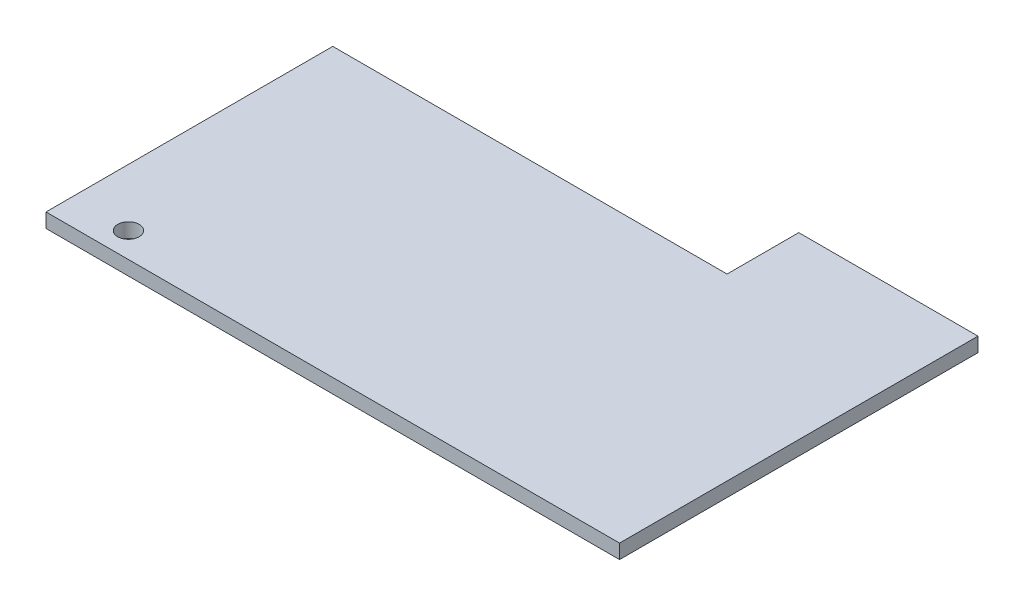
from build123d import *

# Parameters (mm, degrees)
SKETCH1_W           = 80
SKETCH1_H           = 50
BOSS_EXTRUDE1_DEPTH = 2
SKETCH2_R           = 1.5
CUT_EXTRUDE1_DEPTH  = 2
SKETCH3_W           = 55
SKETCH3_H           = 10
CUT_EXTRUDE2_DEPTH  = 95.361008897


with BuildPart() as part:
    # Sketch1 → Boss-Extrude1 (new body)
    with BuildSketch(Plane(origin=(0, 0, 0), x_dir=(1, 0, 0), z_dir=(0, 1, 0))):
        with Locations((40, 25)):
            Rectangle(SKETCH1_W, SKETCH1_H)
    extrude(amount=BOSS_EXTRUDE1_DEPTH)

    # Sketch2 → Cut-Extrude1 (cut)
    with BuildSketch(Plane(origin=(0, 2, 0), x_dir=(1, 0, 0), z_dir=(0, 1, 0))):
        with Locations(Location((8, 3.5, 0), (0, 0, 270))):
            Circle(SKETCH2_R)
    extrude(amount=-CUT_EXTRUDE1_DEPTH, mode=Mode.SUBTRACT)

    # Sketch3 → Cut-Extrude2 (cut, through all)
    with BuildSketch(Plane(origin=(0, 2, 0), x_dir=(1, 0, 0), z_dir=(0, 1, 0))):
        with Locations((27.5, 45)):
            Rectangle(SKETCH3_W, SKETCH3_H)
    extrude(amount=-CUT_EXTRUDE2_DEPTH, mode=Mode.SUBTRACT)


solid = part.part
